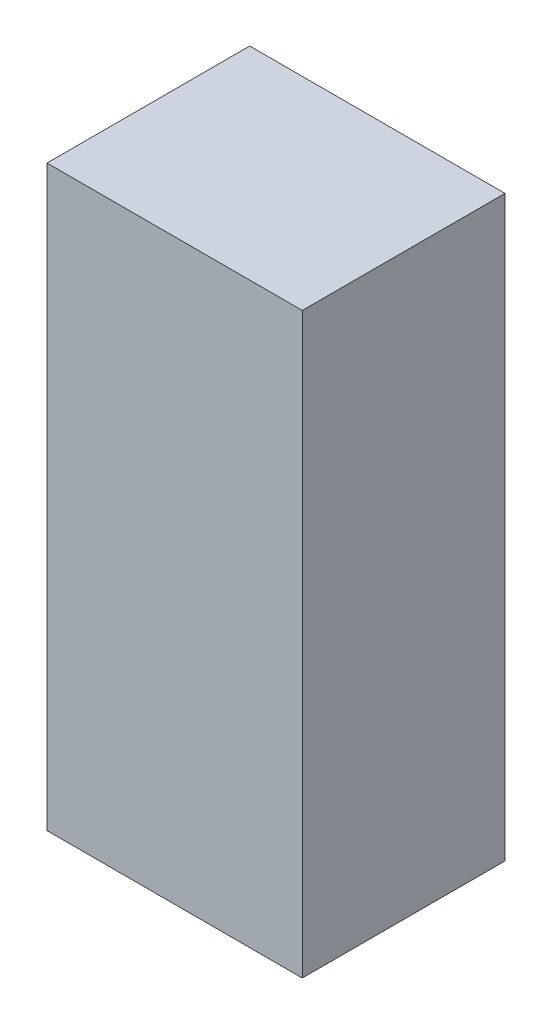
from build123d import *

# Parameters (mm, degrees)
ESBO_O1_W                = 77
ESBO_O1_H                = 34
RESSALTO_EXTRUS_O1_DEPTH = 27


with BuildPart() as part:
    # Esboço1 → Ressalto-extrusão1 (new body)
    with BuildSketch(Plane(origin=(0, 0, 0), x_dir=(0, 1, 0), z_dir=(0, 0, 1))):
        Rectangle(ESBO_O1_W, ESBO_O1_H)
    extrude(amount=RESSALTO_EXTRUS_O1_DEPTH)


solid = part.part
